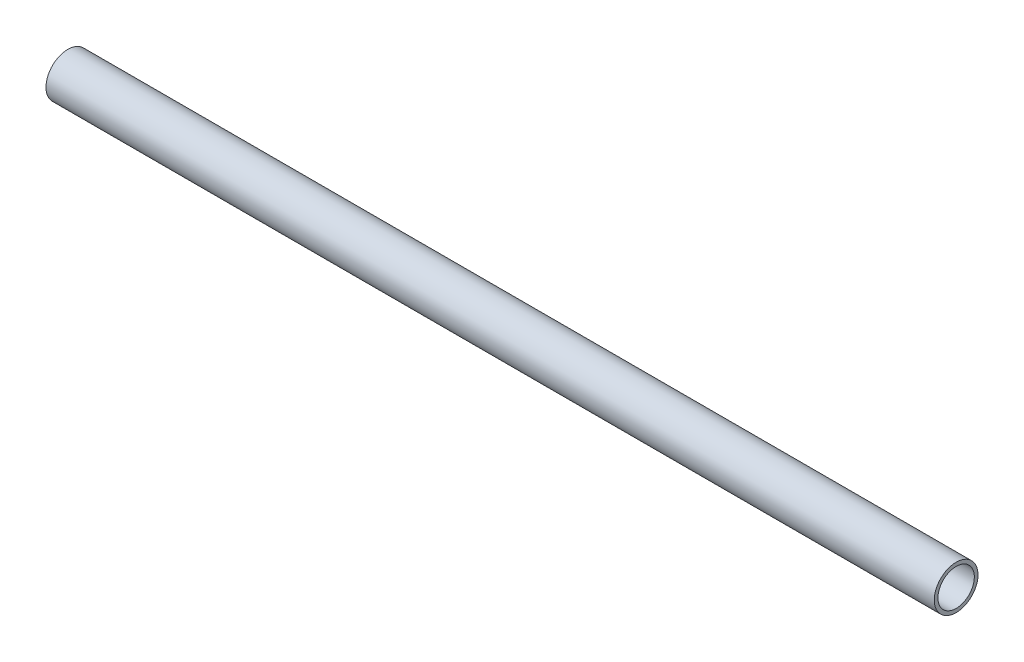
from build123d import *

# Parameters (mm, degrees)
SKETCH11_R              = 6.35
SKETCH11_R_2            = 5.2832
PIPE_0_5_SCH_40_1_DEPTH = 257.93146979


with BuildPart() as part:
    # Sketch11 → Pipe 0.5 SCH 40(1) (new body)
    with BuildSketch(Plane(origin=(17.622221572, 1527.512796137, 0), x_dir=(0, 1, 0), z_dir=(1, 0, 0))):
        Circle(SKETCH11_R)
        Circle(SKETCH11_R_2, mode=Mode.SUBTRACT)
    extrude(amount=PIPE_0_5_SCH_40_1_DEPTH)


solid = part.part
